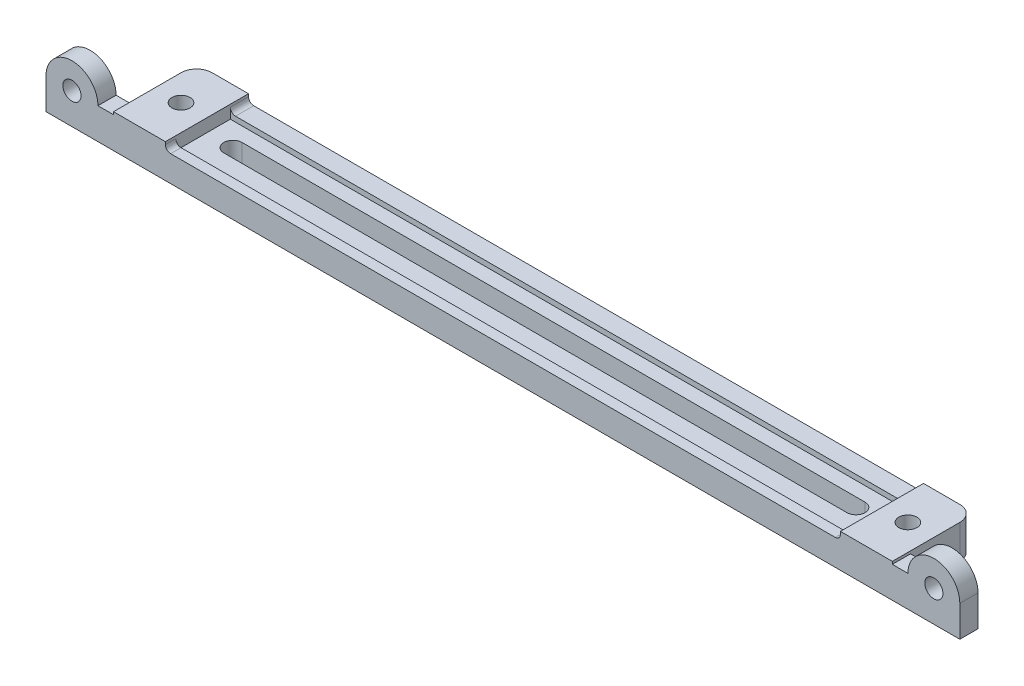
from build123d import *

# Parameters (mm, degrees)
SKETCH1_R           = 1.75
BOSS_EXTRUDE1_DEPTH = 4
SKETCH2_W           = 130
SKETCH2_H           = 10.5
SKETCH2_R           = 1.75
BOSS_EXTRUDE2_DEPTH = 1
SKETCH3_R           = 1.75
BOSS_EXTRUDE3_DEPTH = 1.5
FILLET1_R           = 1
SKETCH4_R           = 1.75
BOSS_EXTRUDE4_DEPTH = 3.5


with BuildPart() as part:
    # Sketch1 → Boss-Extrude1 (new body)
    with BuildSketch(Plane(origin=(0, 0, 0), x_dir=(1, 0, 0), z_dir=(0, 1, 0))):
        with BuildLine():
            Line((-75, -8), (75, -8))
            Line((75, -8), (75, 5))
            ThreePointArc((75, 5), (74.121320344, 7.121320344), (72, 8))
            Line((72, 8), (-72, 8))
            ThreePointArc((-72, 8), (-74.121320344, 7.121320344), (-75, 5))
            Line((-75, 5), (-75, -8))
        make_face()
        with Locations(Location((-70, 0, 0), (0, 0, 270))):
            Circle(SKETCH1_R, mode=Mode.SUBTRACT)
        with BuildLine():
            ThreePointArc((61.75, 0), (61.237436867, -1.237436867), (60, -1.75))
            Line((60, -1.75), (-60, -1.75))
            ThreePointArc((-60, -1.75), (-61.75, 0), (-60, 1.75))
            Line((-60, 1.75), (60, 1.75))
            ThreePointArc((60, 1.75), (61.237436867, 1.237436867), (61.75, 0))
        make_face(mode=Mode.SUBTRACT)
        with Locations(Location((70, 0, 0), (0, 0, 270))):
            Circle(SKETCH1_R, mode=Mode.SUBTRACT)
    extrude(amount=BOSS_EXTRUDE1_DEPTH)

    # Sketch2 → Boss-Extrude2 (add)
    with BuildSketch(Plane(origin=(0, 4, 0), x_dir=(1, 0, 0), z_dir=(0, 1, 0))):
        with BuildLine():
            Line((-75, -8), (75, -8))
            Line((75, -8), (75, 5))
            ThreePointArc((75, 5), (74.121320344, 7.121320344), (72, 8))
            Line((72, 8), (-72, 8))
            ThreePointArc((-72, 8), (-74.121320344, 7.121320344), (-75, 5))
            Line((-75, 5), (-75, -8))
        make_face()
        with Locations((0, -0.75)):
            Rectangle(SKETCH2_W, SKETCH2_H, mode=Mode.SUBTRACT)
        with Locations(Location((-70, 0, 0), (0, 0, 270))):
            Circle(SKETCH2_R, mode=Mode.SUBTRACT)
        with Locations(Location((70, 0, 0), (0, 0, 270))):
            Circle(SKETCH2_R, mode=Mode.SUBTRACT)
    extrude(amount=BOSS_EXTRUDE2_DEPTH)

    # Sketch3 → Boss-Extrude3 (add)
    # profile 1 of 2: a face of its own
    with BuildSketch(Plane(origin=(0, 5, 0), x_dir=(1, 0, 0), z_dir=(0, 1, 0))):
        with BuildLine():
            Line((65, 4.5), (65, 8))
            Line((65, 8), (72, 8))
            ThreePointArc((72, 8), (74.121320344, 7.121320344), (75, 5))
            Line((75, 5), (75, -8))
            Line((75, -8), (65, -8))
            Line((65, -8), (65, -6))
            Line((65, -6), (65, 4.5))
        make_face()
        with Locations(Location((70, 0, 0), (0, 0, 270))):
            Circle(SKETCH3_R, mode=Mode.SUBTRACT)
    # profile 2 of 2: a face of its own
    with BuildSketch(Plane(origin=(0, 5, 0), x_dir=(1, 0, 0), z_dir=(0, 1, 0))):
        with BuildLine():
            Line((-65, 4.5), (-65, 8))
            Line((-65, 8), (-72, 8))
            ThreePointArc((-72, 8), (-74.121320344, 7.121320344), (-75, 5))
            Line((-75, 5), (-75, -8))
            Line((-75, -8), (-65, -8))
            Line((-65, -8), (-65, -6))
            Line((-65, -6), (-65, 4.5))
        make_face()
        with Locations(Location((-70, 0, 0), (0, 0, 270))):
            Circle(SKETCH3_R, mode=Mode.SUBTRACT)
    extrude(amount=BOSS_EXTRUDE3_DEPTH)

    # Fillet1
    fillet1_edges = [part.edges().sort_by_distance(p)[0] for p in [
        (-65, 5, 7),
        (65, 5, 7),
        (65, 5, -6.25),
        (-65, 5, -6.25),
    ]]
    fillet(fillet1_edges, radius=FILLET1_R)

    # Sketch4 → Boss-Extrude4 (add)
    # profile 1 of 2: a face of its own
    with BuildSketch(Plane.XY.offset(8)):
        with BuildLine():
            Line((-88, 0), (-75, 0))
            Line((-75, 0), (-75, 6))
            Line((-75, 6), (-78, 6))
            ThreePointArc((-78, 6), (-83, 11), (-88, 6))
            Line((-88, 6), (-88, 0))
        make_face()
        with Locations((-83, 6)):
            Circle(SKETCH4_R, mode=Mode.SUBTRACT)
    # profile 2 of 2: a face of its own
    with BuildSketch(Plane.XY.offset(8)):
        with BuildLine():
            Line((78, 6), (75, 6))
            Line((75, 6), (75, 0))
            Line((75, 0), (88, 0))
            Line((88, 0), (88, 6))
            ThreePointArc((88, 6), (83, 11), (78, 6))
        make_face()
        with Locations((83, 6)):
            Circle(SKETCH4_R, mode=Mode.SUBTRACT)
    extrude(amount=-BOSS_EXTRUDE4_DEPTH)


solid = part.part
